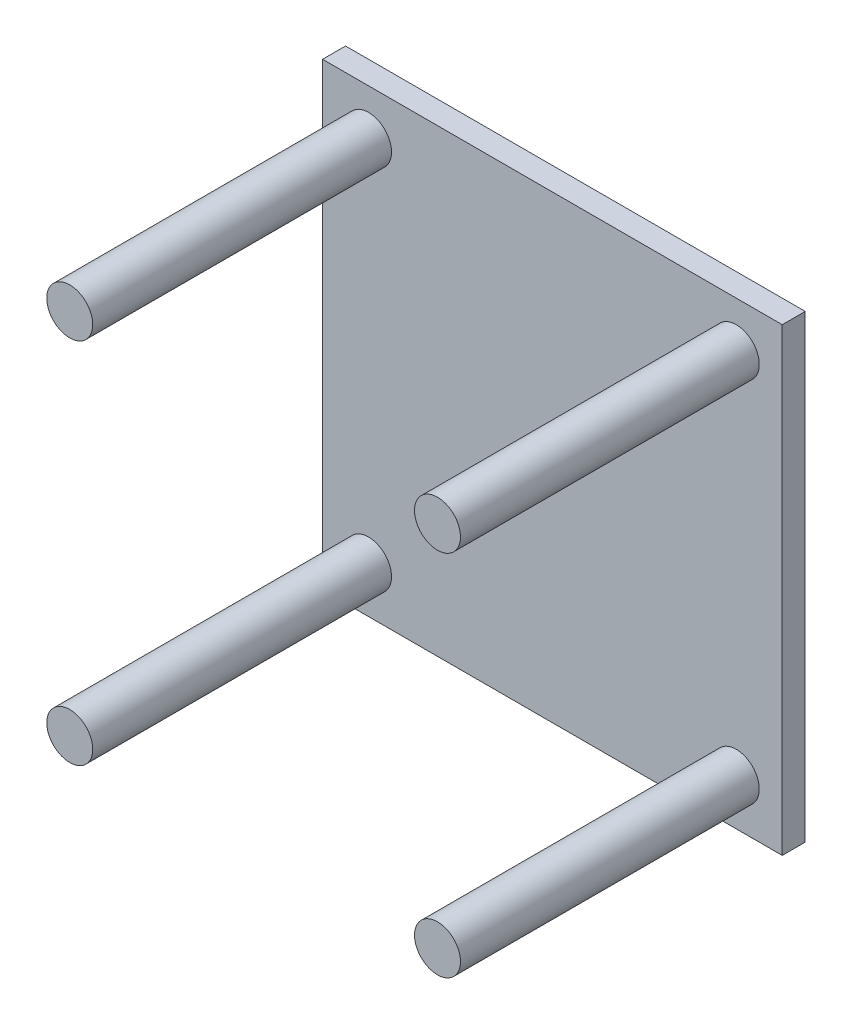
from build123d import *

# Parameters (mm, degrees)
SKETCH_1_W      = 1000
SKETCH_1_H      = 1000
EXTRUDE_1_DEPTH = 50
SKETCH_2_R      = 50
EXTRUDE_2_DEPTH = 700
SKETCH_3_R      = 50
EXTRUDE_3_DEPTH = 700
SKETCH_4_R      = 50
EXTRUDE_4_DEPTH = 700
SKETCH_5_R      = 50
EXTRUDE_5_DEPTH = 700


with BuildPart() as part:
    # 草图1 → 凸台-拉伸1 (new body)
    with BuildSketch(Plane.XY):
        Rectangle(SKETCH_1_W, SKETCH_1_H)
    extrude(amount=EXTRUDE_1_DEPTH)

    # 草图2 → 凸台-拉伸2 (add)
    with BuildSketch(Plane.XY):
        with Locations(Location((400, 400, 0), (0, 0, 180))):
            Circle(SKETCH_2_R)
    extrude(amount=EXTRUDE_2_DEPTH)

    # 草图3 → 凸台-拉伸3 (add)
    with BuildSketch(Plane.XY):
        with Locations(Location((-400, 400, 0), (0, 0, 180))):
            Circle(SKETCH_3_R)
    extrude(amount=EXTRUDE_3_DEPTH)

    # 草图4 → 凸台-拉伸4 (add)
    with BuildSketch(Plane.XY):
        with Locations(Location((400, -400, 0), (0, 0, 180))):
            Circle(SKETCH_4_R)
    extrude(amount=EXTRUDE_4_DEPTH)

    # 草图5 → 凸台-拉伸5 (add)
    with BuildSketch(Plane.XY):
        with Locations(Location((-400, -400, 0), (0, 0, 180))):
            Circle(SKETCH_5_R)
    extrude(amount=EXTRUDE_5_DEPTH)


solid = part.part
